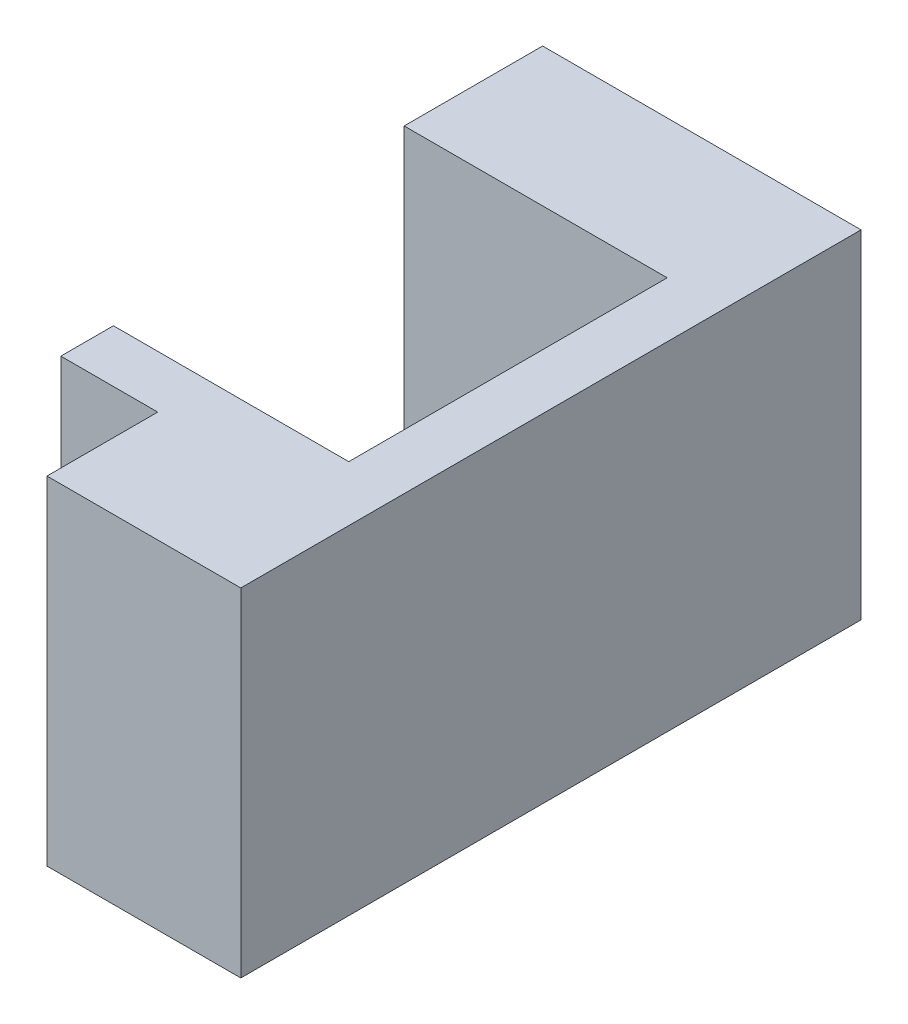
from build123d import *

# Parameters (mm, degrees)
BOSS_EXTRUDE1_DEPTH = 12.2


with BuildPart() as part:
    # Sketch1 → Boss-Extrude1 (new body)
    with BuildSketch(Plane(origin=(0, 0, 0), x_dir=(1, 0, 0), z_dir=(0, 1, 0))):
        Polygon((0, 0), (9.5, 0), (9.5, -11.5), (1, -11.5), (1, -13.4), (4.5, -13.4), (4.5, -17.4), (11.5, -17.4), (11.5, 5), (0, 5), align=None)
    extrude(amount=BOSS_EXTRUDE1_DEPTH)


solid = part.part
